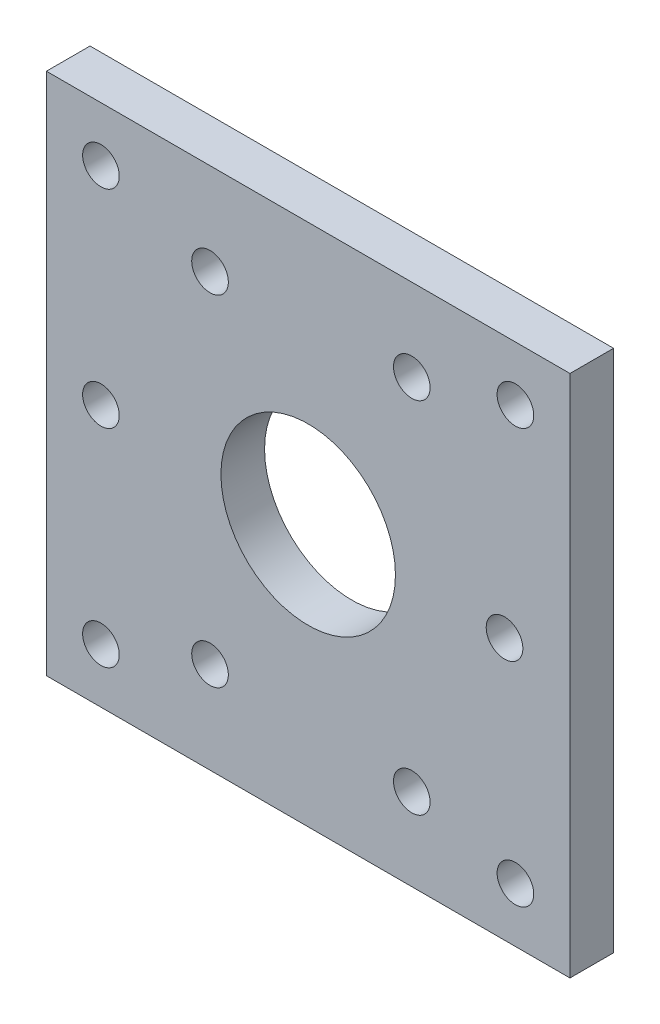
from build123d import *

# Parameters (mm, degrees)
SKETCH_3_W          = 60
SKETCH_3_H          = 60
SKETCH_3_R          = 10
EXTRUDE_2_DEPTH     = 5
SKETCH_4_R          = 2.1
CUT_EXTRUDE_1_DEPTH = 5


with BuildPart() as part:
    # 草图3 → 凸台-拉伸2 (new body)
    with BuildSketch(Plane.XY):
        Rectangle(SKETCH_3_W, SKETCH_3_H)
        Circle(SKETCH_3_R, mode=Mode.SUBTRACT)
    extrude(amount=EXTRUDE_2_DEPTH)

    # 草图4 → 切除-拉伸1 (cut)
    with BuildSketch(Plane.XY):
        with Locations(Location((11.875, 20.56810334, 0), (0, 0, 180))):
            Circle(SKETCH_4_R)
        with Locations(Location((22.5, 0, 0), (0, 0, 180))):
            Circle(SKETCH_4_R)
        with Locations(Location((11.875, -20.56810334, 0), (0, 0, 180))):
            Circle(SKETCH_4_R)
        with Locations(Location((-11.25, -19.485571585, 0), (0, 0, 180))):
            Circle(SKETCH_4_R)
        with Locations(Location((-23.75, 0, 0), (0, 0, 180))):
            Circle(SKETCH_4_R)
        with Locations(Location((-11.25, 19.485571585, 0), (0, 0, 180))):
            Circle(SKETCH_4_R)
        with Locations(Location((-23.75, 23.75, 0), (0, 0, 180))):
            Circle(SKETCH_4_R)
        with Locations(Location((23.75, 23.75, 0), (0, 0, 180))):
            Circle(SKETCH_4_R)
        with Locations(Location((23.75, -23.75, 0), (0, 0, 180))):
            Circle(SKETCH_4_R)
        with Locations(Location((-23.75, -23.75, 0), (0, 0, 180))):
            Circle(SKETCH_4_R)
    extrude(amount=CUT_EXTRUDE_1_DEPTH, mode=Mode.SUBTRACT)


solid = part.part
